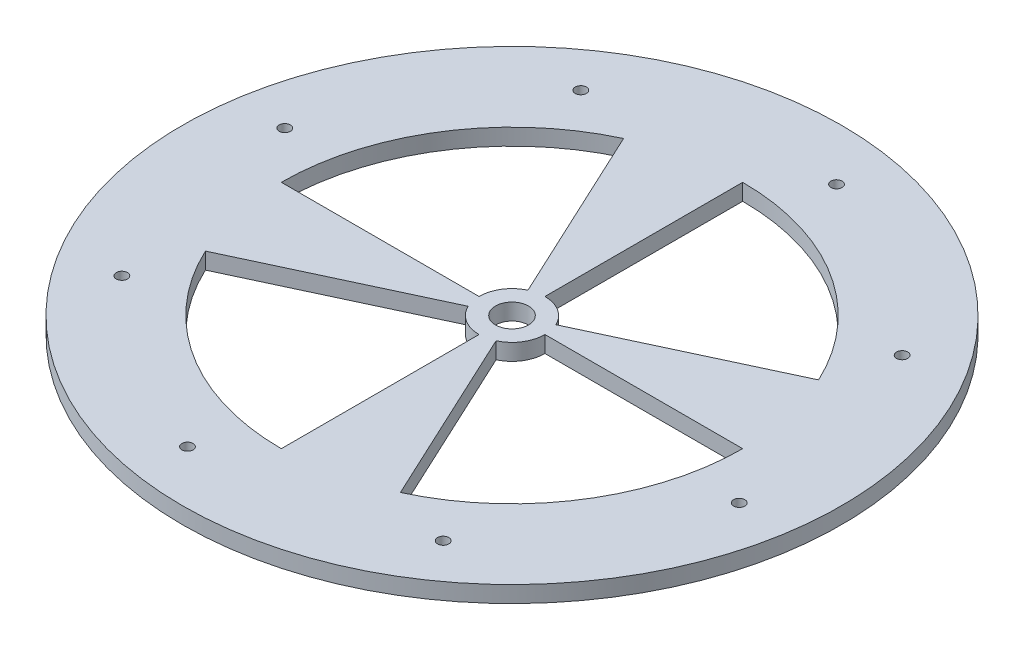
from build123d import *

# Parameters (mm, degrees)
SKETCH1_R           = 254
SKETCH1_R_2         = 12.7
SKETCH1_R_3         = 4.318
BOSS_EXTRUDE3_DEPTH = 12.7


with BuildPart() as part:
    # Sketch1 → Boss-Extrude3 (new body)
    with BuildSketch(Plane(origin=(0, 0, 0), x_dir=(1, 0, 0), z_dir=(0, 1, 0))):
        with Locations(Location((0, 0, 0), (0, 0, 90))):
            Circle(SKETCH1_R)
        with Locations(Location((0, 0, 0), (0, 0, 90))):
            Circle(SKETCH1_R_2, mode=Mode.SUBTRACT)
        with Locations(Location((37.490641558, 212.619993875, 0), (0, 0, 90))):
            Circle(SKETCH1_R_3, mode=Mode.SUBTRACT)
        with Locations(Location((176.854926362, 123.835152608, 0), (0, 0, 90))):
            Circle(SKETCH1_R_3, mode=Mode.SUBTRACT)
        with Locations(Location((212.619993875, -37.490641558, 0), (0, 0, 90))):
            Circle(SKETCH1_R_3, mode=Mode.SUBTRACT)
        with Locations(Location((123.835152608, -176.854926362, 0), (0, 0, 90))):
            Circle(SKETCH1_R_3, mode=Mode.SUBTRACT)
        with Locations(Location((-37.490641558, -212.619993875, 0), (0, 0, 90))):
            Circle(SKETCH1_R_3, mode=Mode.SUBTRACT)
        with Locations(Location((-176.854926362, -123.835152608, 0), (0, 0, 90))):
            Circle(SKETCH1_R_3, mode=Mode.SUBTRACT)
        with Locations(Location((-212.619993875, 37.490641558, 0), (0, 0, 90))):
            Circle(SKETCH1_R_3, mode=Mode.SUBTRACT)
        with Locations(Location((-123.835152608, 176.854926362, 0), (0, 0, 90))):
            Circle(SKETCH1_R_3, mode=Mode.SUBTRACT)
        with BuildLine():
            Line((0, 25.4), (0, 177.8))
            ThreePointArc((0, 177.8), (95.531870364, 149.954999066), (161.141524535, 75.141526937))
            Line((161.141524535, 75.141526937), (23.020217791, 10.734503848))
            ThreePointArc((23.020217791, 10.734503848), (13.647410052, 21.422142724), (0, 25.4))
        make_face(mode=Mode.SUBTRACT)
        with BuildLine():
            Line((10.734503848, -23.020217791), (75.141526937, -161.141524535))
            ThreePointArc((75.141526937, -161.141524535), (149.954999066, -95.531870364), (177.8, 0))
            Line((177.8, 0), (25.4, 0))
            ThreePointArc((25.4, 0), (21.422142724, -13.647410052), (10.734503848, -23.020217791))
        make_face(mode=Mode.SUBTRACT)
        with BuildLine():
            Line((-23.020217791, -10.734503848), (-161.141524535, -75.141526937))
            ThreePointArc((-161.141524535, -75.141526937), (-95.531870364, -149.954999066), (0, -177.8))
            Line((0, -177.8), (0, -25.4))
            ThreePointArc((0, -25.4), (-13.647410052, -21.422142724), (-23.020217791, -10.734503848))
        make_face(mode=Mode.SUBTRACT)
        with BuildLine():
            Line((-10.734503848, 23.020217791), (-75.141526937, 161.141524535))
            ThreePointArc((-75.141526937, 161.141524535), (-149.954999066, 95.531870364), (-177.8, 0))
            Line((-177.8, 0), (-25.4, 0))
            ThreePointArc((-25.4, 0), (-21.422142724, 13.647410052), (-10.734503848, 23.020217791))
        make_face(mode=Mode.SUBTRACT)
    extrude(amount=BOSS_EXTRUDE3_DEPTH)


solid = part.part
